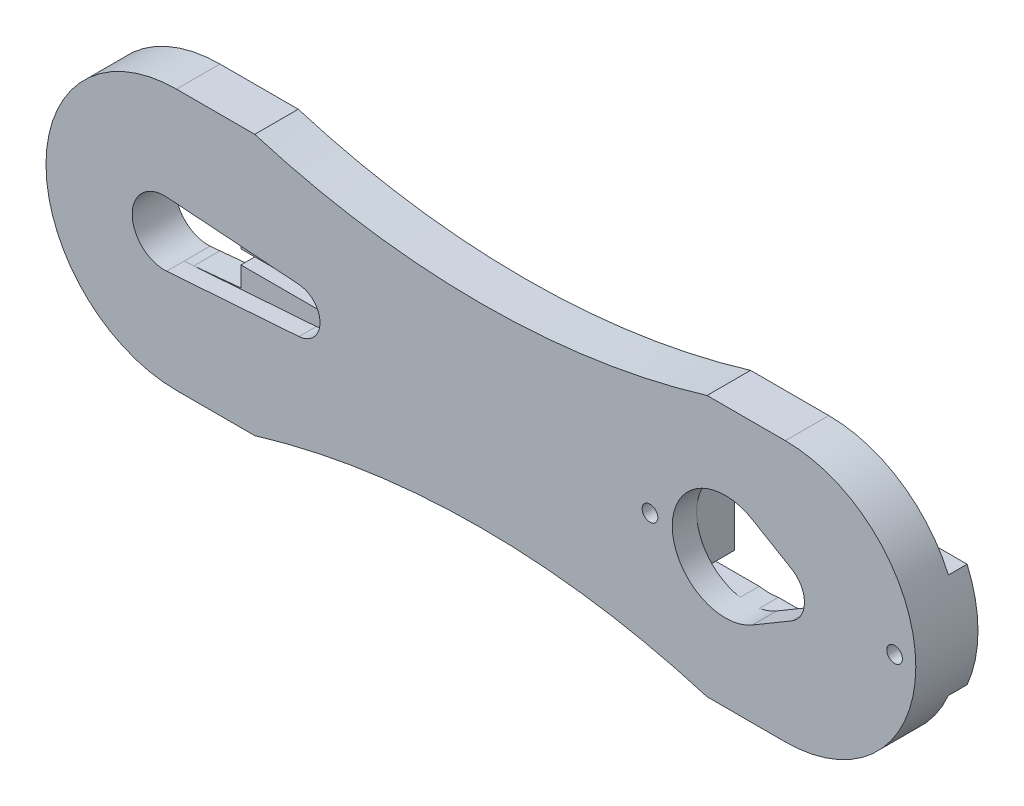
from build123d import *
from build123d.topology import SkipClean

# Parameters (mm, degrees)
BOSS_EXTRUDE1_DEPTH        = 5
CROQUIS3_W                 = 23
CROQUIS3_H                 = 12
CORTAR_EXTRUIR2_DEPTH      = 2.2
CORTAR_EXTRUIR3_DEPTH      = 91.182259896
CORTAR_EXTRUIR3_DEPTH_BACK = 91.182259896
CUT_EXTRUDE4_DEPTH         = 91.277350426
CUT_EXTRUDE4_DEPTH_BACK    = 2
CUT_EXTRUDE6_DEPTH         = 91.188691087
BOSS_EXTRUDE2_START        = 2.15
SKETCH9_W                  = 5
SKETCH9_H                  = 12
BOSS_EXTRUDE2_DEPTH        = 2.15
SKETCH10_R                 = 0.9
CUT_EXTRUDE7_DEPTH         = 8
CUT_EXTRUDE8_DEPTH         = 91.28578238


with BuildPart() as part:
    # Sketch1 → Boss-Extrude1 (new body)
    with BuildSketch(Plane(origin=(0, 0, 0), x_dir=(-1, 0, 0), z_dir=(0, 0, -1))):
        with BuildLine():
            Line((-70, 0), (-61, 0))
            ThreePointArc((-61, 0), (-35, -3.837363086), (-9, 0))
            Line((-9, 0), (0, 0))
            ThreePointArc((0, 0), (15, -15), (0, -30))
            Line((0, -30), (-9, -30))
            ThreePointArc((-9, -30), (-35, -26.162636914), (-61, -30))
            Line((-61, -30), (-70, -30))
            ThreePointArc((-70, -30), (-85, -15), (-70, 0))
        make_face()
        with BuildLine():
            Line((0, -11.4), (-5.4, -11.905))
            Line((-5.4, -11.905), (-5.4, -18.095))
            Line((-5.4, -18.095), (0, -18.6))
            ThreePointArc((0, -18.6), (3.6, -15), (0, -11.4))
        make_face(mode=Mode.SUBTRACT)
    extrude(amount=-BOSS_EXTRUDE1_DEPTH)

    # Croquis3 → Cortar-Extruir2 (cut)
    with BuildSketch(Plane(origin=(0, 0, 0), x_dir=(-1, 0, 0), z_dir=(0, 0, -1))):
        with Locations((-68.5, -15)):
            Rectangle(CROQUIS3_W, CROQUIS3_H)
    extrude(amount=-CORTAR_EXTRUIR2_DEPTH, mode=Mode.SUBTRACT)

    # Croquis4 → Cortar-Extruir3 (cut, two sides: drawn at the far end of the back side and taken through both)
    with BuildSketch(Plane(origin=(0, 0, 2.2), x_dir=(-1, 0, 0), z_dir=(0, 0, -1)).offset(-CORTAR_EXTRUIR3_DEPTH_BACK)):
        with BuildLine():
            Line((-66.2, -9.746429785), (-70.724590164, -12.416276944))
            ThreePointArc((-70.724590164, -12.416276944), (-72.2, -15), (-70.724590164, -17.583723056))
            Line((-70.724590164, -17.583723056), (-66.2, -20.253570215))
            ThreePointArc((-66.2, -20.253570215), (-57, -15), (-66.2, -9.746429785))
        make_face()
    extrude(amount=CORTAR_EXTRUIR3_DEPTH + CORTAR_EXTRUIR3_DEPTH_BACK, mode=Mode.SUBTRACT)

    # Sketch6 → Cut-Extrude4 (cut, two sides: drawn at the far end of the back side and taken through both)
    with BuildSketch(Plane.XY.offset(5).offset(-CUT_EXTRUDE4_DEPTH_BACK)):
        with BuildLine():
            Line((14.08705036, -12.406737159), (-1.12381295, -11.309587495))
            ThreePointArc((-1.12381295, -11.309587495), (-5.09, -15), (-1.12381295, -18.690412505))
            Line((-1.12381295, -18.690412505), (14.08705036, -17.593262841))
            ThreePointArc((14.08705036, -17.593262841), (16.5, -15), (14.08705036, -12.406737159))
        make_face()
    extrude(amount=CUT_EXTRUDE4_DEPTH + CUT_EXTRUDE4_DEPTH_BACK, mode=Mode.SUBTRACT)

    # Sketch8 → Cut-Extrude6 (cut, through all)
    with SkipClean():  # the faces are left unmerged after this step: merging them gives an invalid solid
        with BuildSketch(Plane.XY.offset(3)):
            with BuildLine():
                Line((-1.12381295, -11.309587495), (0, -11.4))
                ThreePointArc((0, -11.4), (-3.6, -15), (0, -18.6))
                Line((0, -18.6), (-1.12381295, -18.690412505))
                ThreePointArc((-1.12381295, -18.690412505), (-5.09, -15), (-1.12381295, -11.309587495))
            make_face()
        extrude(amount=-CUT_EXTRUDE6_DEPTH, mode=Mode.SUBTRACT)

    # Sketch9 → Boss-Extrude2 (add)
    with SkipClean():  # the faces are left unmerged after this step: merging them gives an invalid solid
        with BuildSketch(Plane(origin=(0, 0, 0), x_dir=(-1, 0, 0), z_dir=(0, 0, -1)).offset(BOSS_EXTRUDE2_START)):
            with BuildLine():
                Line((-83.747727085, -21), (-80, -21))
                Line((-80, -21), (-80, -9))
                Line((-80, -9), (-83.747727085, -9))
                ThreePointArc((-83.747727085, -9), (-85, -15), (-83.747727085, -21))
            make_face()
            with Locations((-54.5, -15)):
                Rectangle(SKETCH9_W, SKETCH9_H)
        extrude(amount=-BOSS_EXTRUDE2_DEPTH)

    # Sketch10 → Cut-Extrude7 (cut)
    with SkipClean():  # the faces are left unmerged after this step: merging them gives an invalid solid
        with BuildSketch(Plane(origin=(0, 0, -2.15), x_dir=(-1, 0, 0), z_dir=(0, 0, -1))):
            with Locations((-54.44, -15)):
                Circle(SKETCH10_R)
            with Locations((-82.56, -15)):
                Circle(SKETCH10_R)
        extrude(amount=-CUT_EXTRUDE7_DEPTH, mode=Mode.SUBTRACT)

    # Sketch11 → Cut-Extrude8 (cut, through all)
    with SkipClean():  # the faces are left unmerged after this step: merging them gives an invalid solid
        with BuildSketch(Plane.XY.offset(3)):
            with BuildLine():
                Line((5.4, -14.2), (14.9, -14.2))
                ThreePointArc((14.9, -14.2), (15.7, -15), (14.9, -15.8))
                Line((14.9, -15.8), (5.4, -15.8))
                Line((5.4, -15.8), (5.4, -14.2))
            make_face()
        extrude(amount=-CUT_EXTRUDE8_DEPTH, mode=Mode.SUBTRACT)


solid = part.part
